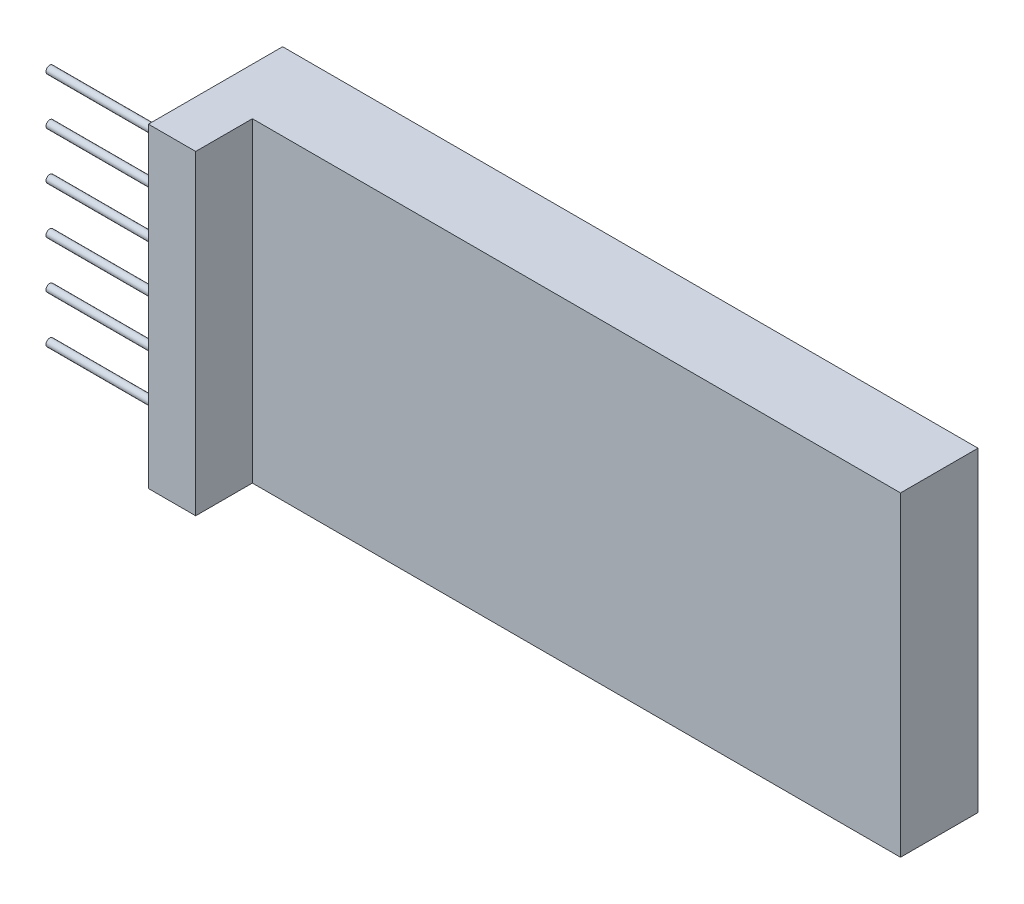
from build123d import *

# Parameters (mm, degrees)
SKETCH_1_W      = 36.8
SKETCH_1_H      = 16.7
EXTRUDE_1_DEPTH = 4.1
SKETCH_2_W      = 2.5
SKETCH_2_H      = 16.7
EXTRUDE_2_DEPTH = 3
SKETCH_3_R      = 0.2
EXTRUDE_3_DEPTH = 6.65


with BuildPart() as part:
    # 草图1 → 凸台-拉伸1 (new body)
    with BuildSketch(Plane.XY):
        with Locations((18.4, 8.35)):
            Rectangle(SKETCH_1_W, SKETCH_1_H)
    extrude(amount=EXTRUDE_1_DEPTH)

    # 草图2 → 凸台-拉伸2 (add)
    with BuildSketch(Plane.XY.offset(4.1)):
        with Locations((1.25, 8.35)):
            Rectangle(SKETCH_2_W, SKETCH_2_H)
    extrude(amount=EXTRUDE_2_DEPTH)

    # 草图3 → 凸台-拉伸3 (add)
    with BuildSketch(Plane.ZY):
        with Locations(Location((5.671300253, 15.164518481, 0), (0, 0, 180))):
            Circle(SKETCH_3_R)
        with Locations(Location((5.671300253, 12.664518481, 0), (0, 0, 180))):
            Circle(SKETCH_3_R)
        with Locations(Location((5.671300253, 10.164518481, 0), (0, 0, 180))):
            Circle(SKETCH_3_R)
        with Locations(Location((5.671300253, 7.664518481, 0), (0, 0, 180))):
            Circle(SKETCH_3_R)
        with Locations(Location((5.671300253, 5.164518481, 0), (0, 0, 180))):
            Circle(SKETCH_3_R)
        with Locations(Location((5.671300253, 2.664518481, 0), (0, 0, 180))):
            Circle(SKETCH_3_R)
    extrude(amount=EXTRUDE_3_DEPTH)


solid = part.part
